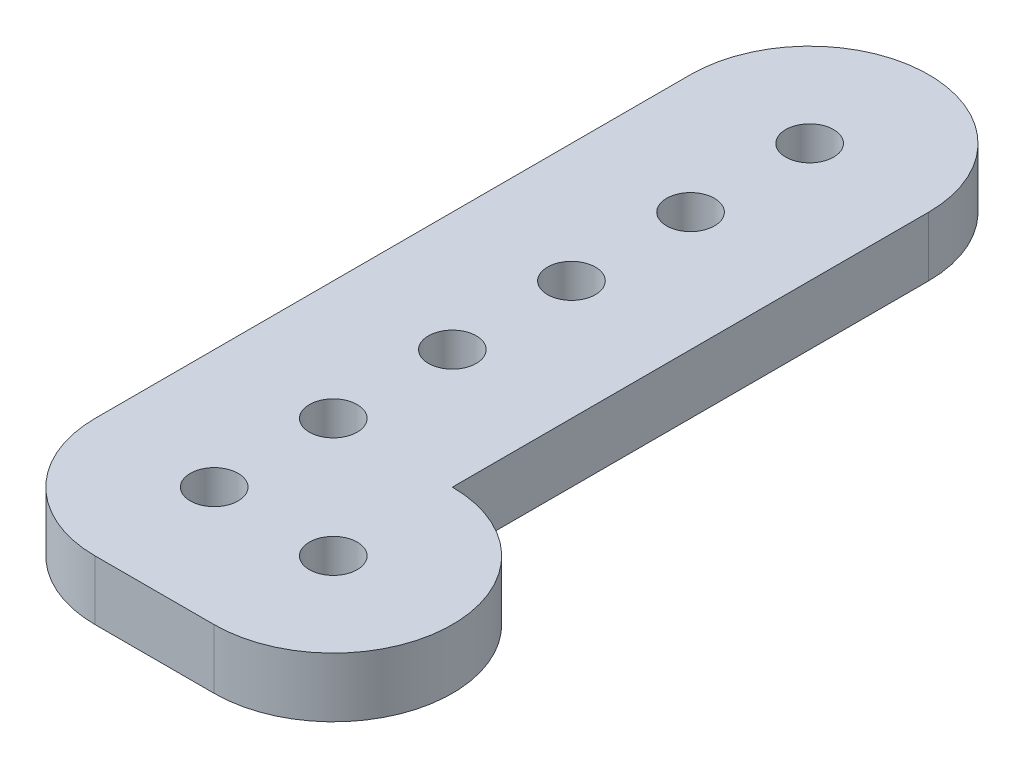
from build123d import *

# Parameters (mm, degrees)
SKETCH1_R           = 2.5527
BOSS_EXTRUDE1_DEPTH = 3.175


with BuildPart() as part:
    # Sketch1 → Boss-Extrude1 (new, symmetric)
    # profile 1 of 3: a face of its own
    with BuildSketch(Plane(origin=(0, 0, 0), x_dir=(1, 0, 0), z_dir=(0, 1, 0))):
        with BuildLine():
            Line((0, -12.7), (12.7, -12.7))
            ThreePointArc((12.7, -12.7), (25.4, 0), (12.7, 12.7))
            Line((12.7, 12.7), (12.7, 2.5527))
            ThreePointArc((12.7, 2.5527), (14.50503148, 1.80503148), (15.2527, 0))
            ThreePointArc((15.2527, 0), (14.411927484, -1.893563196), (12.44345365, -2.539775829))
            ThreePointArc((12.44345365, -2.539775829), (8.032273868, -9.837305348), (0, -12.7))
        make_face()
    # profile 2 of 3: a face of its own
    with BuildSketch(Plane(origin=(0, 0, 0), x_dir=(1, 0, 0), z_dir=(0, 1, 0))):
        with BuildLine():
            ThreePointArc((-12.7, 0), (-8.980256121, -8.980256121), (0, -12.7))
            ThreePointArc((0, -12.7), (8.032273868, -9.837305348), (12.44345365, -2.539775829))
            ThreePointArc((12.44345365, -2.539775829), (10.15053309, 0.128435844), (12.7, 2.5527))
            Line((12.7, 2.5527), (12.7, 12.7))
            Line((12.7, 12.7), (2.5527, 12.7))
            ThreePointArc((2.5527, 12.7), (0.128435844, 10.15053309), (-2.539775829, 12.44345365))
            ThreePointArc((-2.539775829, 12.44345365), (-9.837305348, 8.032273868), (-12.7, 0))
        make_face()
        with Locations(Location((0, 0, 0), (0, 0, 270))):
            Circle(SKETCH1_R, mode=Mode.SUBTRACT)
    # profile 3 of 3: a face of its own
    with BuildSketch(Plane(origin=(0, 0, 0), x_dir=(1, 0, 0), z_dir=(0, 1, 0))):
        with BuildLine():
            Line((2.5527, 12.7), (12.7, 12.7))
            Line((12.7, 12.7), (12.7, 63.5))
            ThreePointArc((12.7, 63.5), (0, 76.2), (-12.7, 63.5))
            Line((-12.7, 63.5), (-12.7, 0))
            ThreePointArc((-12.7, 0), (-9.837305348, 8.032273868), (-2.539775829, 12.44345365))
            ThreePointArc((-2.539775829, 12.44345365), (-0.128435844, 15.24946691), (2.5527, 12.7))
        make_face()
        with Locations(Location((0, 25.4, 0), (0, 0, 270))):
            Circle(SKETCH1_R, mode=Mode.SUBTRACT)
        with Locations(Location((0, 38.1, 0), (0, 0, 270))):
            Circle(SKETCH1_R, mode=Mode.SUBTRACT)
        with Locations(Location((0, 50.8, 0), (0, 0, 270))):
            Circle(SKETCH1_R, mode=Mode.SUBTRACT)
        with Locations(Location((0, 63.5, 0), (0, 0, 270))):
            Circle(SKETCH1_R, mode=Mode.SUBTRACT)
    extrude(amount=BOSS_EXTRUDE1_DEPTH, both=True)


solid = part.part
